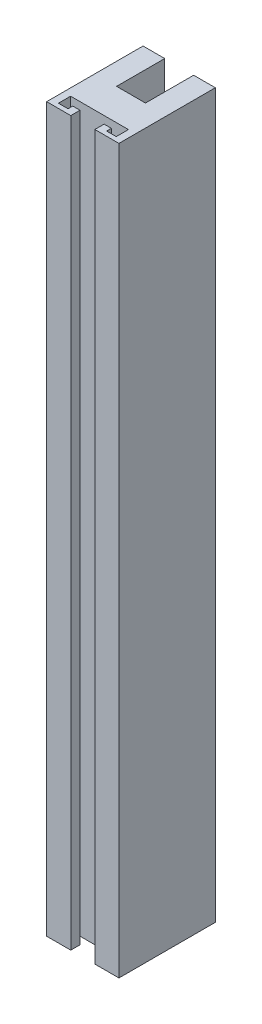
from build123d import *

# Parameters (mm, degrees)
RESSALTO_EXTRUS_O1_DEPTH = 150


with BuildPart() as part:
    # Esboço1 → Ressalto-extrusão1 (new body)
    with BuildSketch(Plane(origin=(0, 0, 0), x_dir=(1, 0, 0), z_dir=(0, 1, 0))):
        Polygon((3, 7.5), (7.5, 7.5), (7.5, -7.5), (7.5, -12.5047377), (2.5, -12.5047377), (2.5, -10.5847377), (4, -10.5847377), (4, -11.566741313), (6, -11.566741313), (6, -9.036092961), (-6, -9.036092961), (-6, -11.5647377), (-4, -11.5647377), (-4, -10.585059624), (-2.5, -10.585059624), (-2.5, -12.5047377), (-7.5, -12.5047377), (-7.5, -7.5), (-7.5, 7.5), (-3, 7.5), (-3, -2.5), (3, -2.5), align=None)
    extrude(amount=RESSALTO_EXTRUS_O1_DEPTH)


solid = part.part
